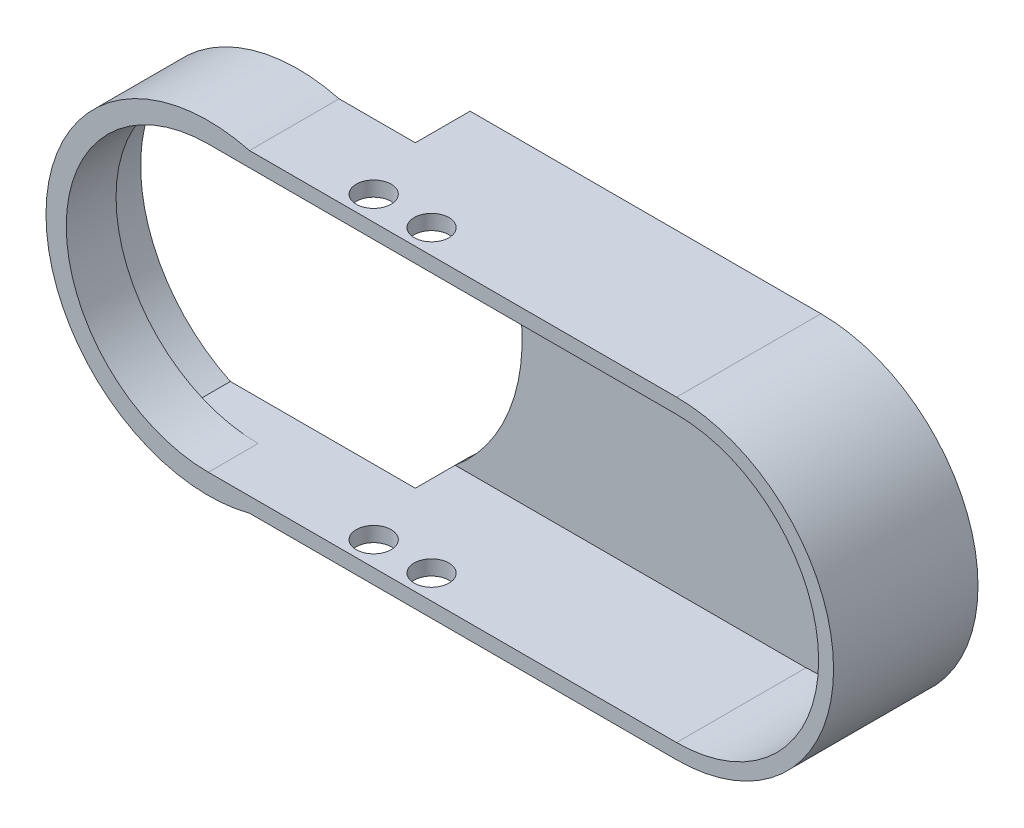
from build123d import *
from build123d.topology import SkipClean

# Parameters (mm, degrees)
BOSS_EXTRUDE2_DEPTH = 3
BOSS_EXTRUDE3_DEPTH = 26
SKETCH8_R           = 3.5
CUT_EXTRUDE1_DEPTH  = 97.30944019
BOSS_EXTRUDE4_DEPTH = 10
BOSS_EXTRUDE5_DEPTH = 8


with BuildPart() as part:
    # Sketch5 → Boss-Extrude2 (new body)
    with BuildSketch(Plane.XY):
        with BuildLine():
            Line((-35.2233955, 28.535), (-35.2233955, 31.535))
            Line((-35.2233955, 31.535), (35.2233955, 31.535))
            ThreePointArc((35.2233955, 31.535), (66.758392935, 0), (35.2233955, -31.535))
            Line((35.2233955, -31.535), (-35.2233955, -31.535))
            Line((-35.2233955, -31.535), (-35.2233955, -28.535))
            ThreePointArc((-35.2233955, -28.535), (-21.776607065, 0), (-35.2233955, 28.535))
        make_face()
    extrude(amount=BOSS_EXTRUDE2_DEPTH)

    # Sketch7 → Boss-Extrude3 (add)
    with BuildSketch(Plane.XY.offset(3)):
        with BuildLine():
            Line((35.2233955, 31.535), (-35.2233955, 31.535))
            Line((-35.2233955, 31.535), (-35.2233955, 28.535))
            Line((-35.2233955, 28.535), (35.2233955, 28.535))
            ThreePointArc((35.2233955, 28.535), (63.7583955, 0), (35.2233955, -28.535))
            Line((35.2233955, -28.535), (-35.2233955, -28.535))
            Line((-35.2233955, -28.535), (-35.2233955, -31.535))
            Line((-35.2233955, -31.535), (35.2233955, -31.535))
            ThreePointArc((35.2233955, -31.535), (66.7583955, 0), (35.2233955, 31.535))
        make_face()
    extrude(amount=BOSS_EXTRUDE3_DEPTH)

    # Sketch8 → Cut-Extrude1 (cut, through all)
    with BuildSketch(Plane(origin=(0, 31.535, 0), x_dir=(1, 0, 0), z_dir=(0, 1, 0))):
        with Locations(Location((-18.8433955, -24.12, 0), (0, 0, 270))):
            Circle(SKETCH8_R)
        with Locations(Location((-30.4633955, -24.12, 0), (0, 0, 270))):
            Circle(SKETCH8_R)
    extrude(amount=-CUT_EXTRUDE1_DEPTH, mode=Mode.SUBTRACT)

    # Sketch9 → Boss-Extrude4 (add)
    with BuildSketch(Plane.XY.offset(29)):
        with BuildLine():
            Line((-50.515390209, 31.535), (-35.2233955, 31.535))
            Line((-35.2233955, 31.535), (-35.2233955, 28.535))
            Line((-35.2233955, 28.535), (-58.78, 28.535))
            ThreePointArc((-58.78, 28.535), (-87.315, 0), (-58.78, -28.535))
            Line((-58.78, -28.535), (-35.2233955, -28.535))
            Line((-35.2233955, -28.535), (-35.2233955, -31.535))
            Line((-35.2233955, -31.535), (-50.515390209, -31.535))
            ThreePointArc((-50.515390209, -31.535), (-91.38, 0), (-50.515390209, 31.535))
        make_face()
    extrude(amount=-BOSS_EXTRUDE4_DEPTH)

    # Sketch11 → Boss-Extrude5 (add)
    with SkipClean():  # the faces are left unmerged after this step: merging them gives an invalid solid
        with BuildSketch(Plane(origin=(0, 0, 19), x_dir=(-1, 0, 0), z_dir=(0, 0, -1))):
            with BuildLine():
                Line((72.35622094, 28.535), (35.2233955, 28.535))
                Line((35.2233955, 28.535), (35.2233955, 31.535))
                Line((35.2233955, 31.535), (50.515390209, 31.535))
                ThreePointArc((50.515390209, 31.535), (91.38, 0), (50.515390209, -31.535))
                Line((50.515390209, -31.535), (35.2233955, -31.535))
                Line((35.2233955, -31.535), (35.2233955, -28.535))
                Line((35.2233955, -28.535), (72.35622094, -28.535))
                ThreePointArc((72.35622094, -28.535), (90.38, 0), (72.35622094, 28.535))
            make_face()
        extrude(amount=BOSS_EXTRUDE5_DEPTH)


solid = part.part
